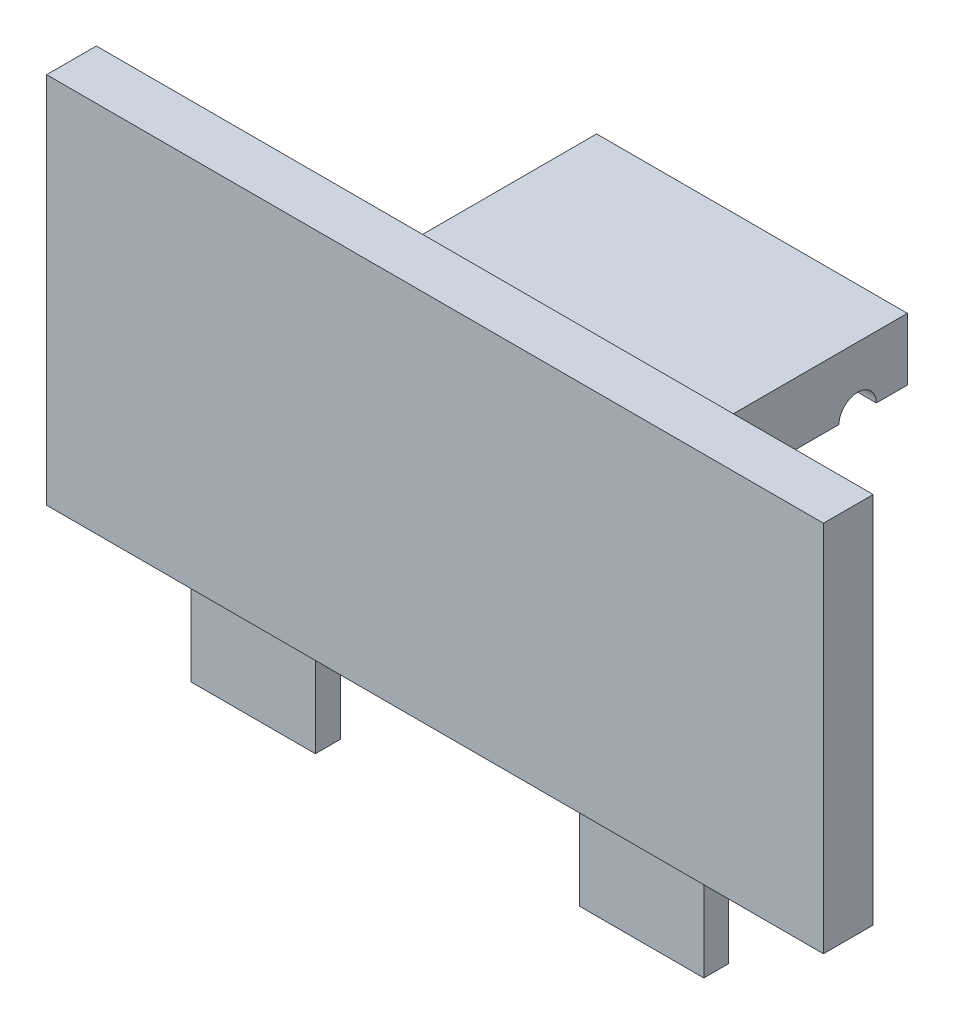
from build123d import *

# Parameters (mm, degrees)
SKETCH_1_W      = 125
SKETCH_1_H      = 8
EXTRUDE_1_DEPTH = 60
SKETCH_2_W      = 50
SKETCH_2_H      = 10
EXTRUDE_2_DEPTH = 43
SKETCH_3_W      = 20
SKETCH_3_H      = 4
EXTRUDE_3_DEPTH = 15
SKETCH_4_W      = 50
SKETCH_4_H      = 3


with BuildPart() as part:
    # 草图1 → 凸台-拉伸1 (new body)
    with BuildSketch(Plane(origin=(0, 0, 0), x_dir=(1, 0, 0), z_dir=(0, 1, 0))):
        with Locations((62.5, 4)):
            Rectangle(SKETCH_1_W, SKETCH_1_H)
    extrude(amount=EXTRUDE_1_DEPTH)

    # 草图2 → 凸台-拉伸2 (add)
    with BuildSketch(Plane(origin=(0, 0, -8), x_dir=(-1, 0, 0), z_dir=(0, 0, -1))):
        with Locations((-62.5, 40)):
            Rectangle(SKETCH_2_W, SKETCH_2_H)
    extrude(amount=EXTRUDE_2_DEPTH)

    # 草图3 → 凸台-拉伸3 (add)
    with BuildSketch(Plane.XZ):
        with Locations((31.25, -4)):
            Rectangle(SKETCH_3_W, SKETCH_3_H)
        with Locations((93.75, -4)):
            Rectangle(SKETCH_3_W, SKETCH_3_H)
    extrude(amount=EXTRUDE_3_DEPTH)

    # 草图4 → 切除-旋转1 (revolve, cut)
    with BuildSketch(Plane.XZ.offset(-35)):
        with Locations((62.5, -44.5)):
            Rectangle(SKETCH_4_W, SKETCH_4_H)
    revolve(axis=Axis((37.5, 35, -43), (1, 0, 0)), mode=Mode.SUBTRACT)


solid = part.part
